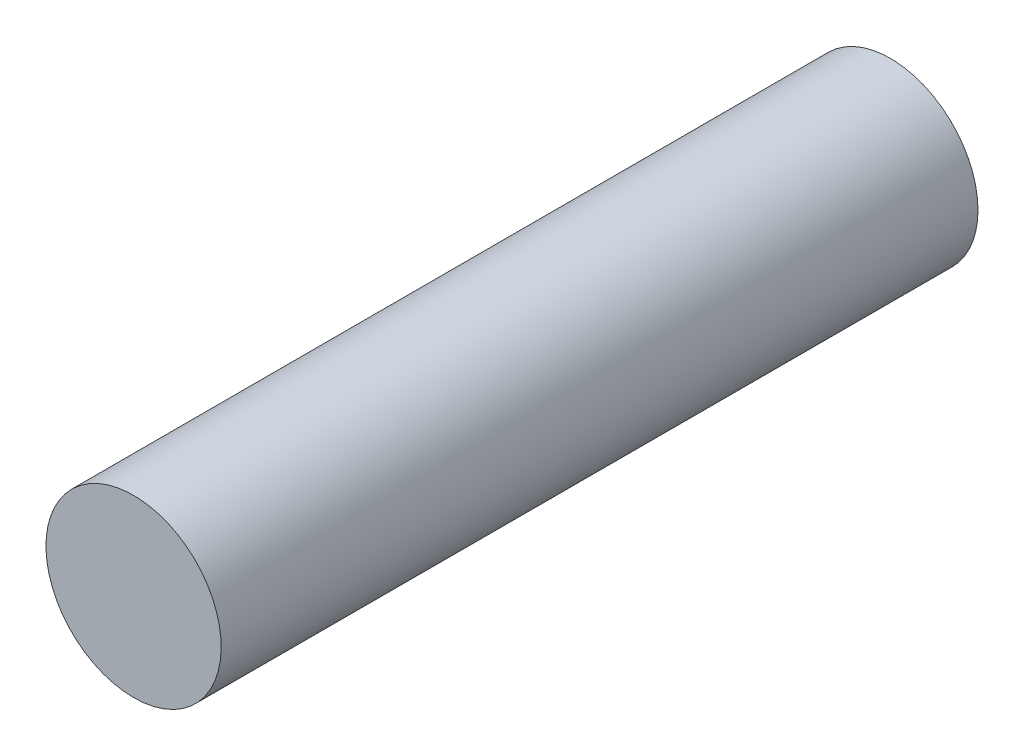
from build123d import *

# Parameters (mm, degrees)
EXTRUDE_1_DEPTH = 40
SKETCH_3_R      = 5
EXTRUDE_2_DEPTH = 3.2


with BuildPart() as part:
    # 草图2 → 凸台-拉伸1 (new body)
    with BuildSketch(Plane.XY):
        with BuildLine():
            Line((3.612202405, 15.15), (7.287797595, 15.15))
            ThreePointArc((7.287797595, 15.15), (5.45, 15.5), (3.612202405, 15.15))
        make_face()
        with BuildLine():
            ThreePointArc((10.45, 10.5), (9.584548825, 13.31167317), (7.287797595, 15.15))
            Line((7.287797595, 15.15), (3.612202405, 15.15))
            ThreePointArc((3.612202405, 15.15), (2.63832683, 6.365451175), (10.45, 10.5))
        make_face()
    extrude(amount=EXTRUDE_1_DEPTH)

    # 草图3 → 凸台-拉伸2 (add)
    with BuildSketch(Plane.XY.offset(40)):
        with Locations(Location((5.45, 10.5, 0), (0, 0, 270))):
            Circle(SKETCH_3_R)
    extrude(amount=EXTRUDE_2_DEPTH)


solid = part.part
